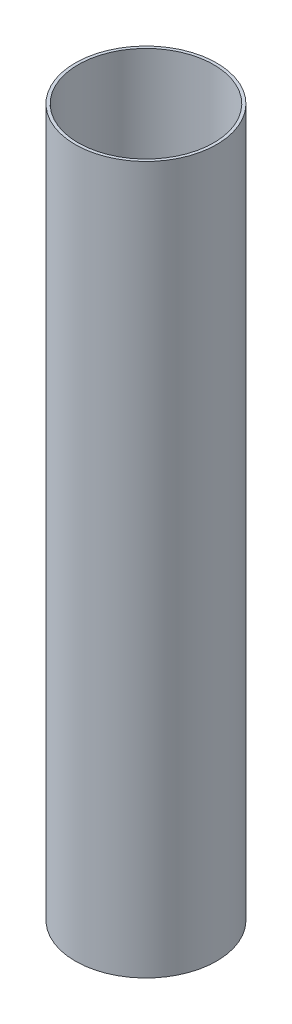
from build123d import *

# Parameters (mm, degrees)
SKETCH1_R           = 76.2
SKETCH1_R_2         = 73.025
BOSS_EXTRUDE1_DEPTH = 762


with BuildPart() as part:
    # Sketch1 → Boss-Extrude1 (new body)
    with BuildSketch(Plane(origin=(0, 0, 0), x_dir=(1, 0, 0), z_dir=(0, 1, 0))):
        with Locations(Location((0, 0, 0), (0, 0, 270))):
            Circle(SKETCH1_R)
        with Locations(Location((0, 0, 0), (0, 0, 270))):
            Circle(SKETCH1_R_2, mode=Mode.SUBTRACT)
    extrude(amount=BOSS_EXTRUDE1_DEPTH)


solid = part.part
